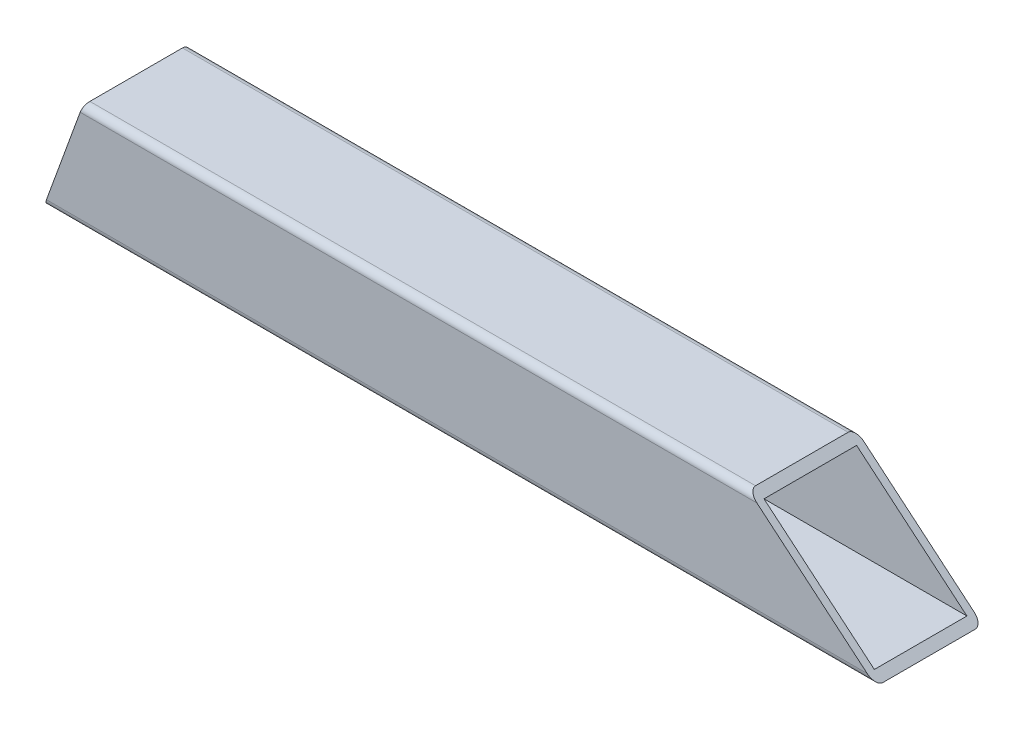
from build123d import *

# Parameters (mm, degrees)
SKETCH1_W               = 130
SKETCH1_H               = 130
EXTRUDE1_DEPTH          = 1168
CUT_EXTRUDE1_DEPTH      = 1188.107408788
CUT_EXTRUDE1_DEPTH_BACK = 1188.107408788
CUT_EXTRUDE2_DEPTH      = 1188.107408788
CUT_EXTRUDE2_DEPTH_BACK = 1188.107408788


with BuildPart() as part:
    # Sketch1 → Extrude1 (new body)
    with BuildSketch(Plane(origin=(0, 0, 0), x_dir=(0, 0, -1), z_dir=(1, 0, 0))):
        with BuildLine():
            Line((10, 0), (140, 0))
            ThreePointArc((140, 0), (147.071067812, 2.928932188), (150, 10))
            Line((150, 10), (150, 140))
            ThreePointArc((150, 140), (147.071067812, 147.071067812), (140, 150))
            Line((140, 150), (10, 150))
            ThreePointArc((10, 150), (2.928932188, 147.071067812), (0, 140))
            Line((0, 140), (0, 10))
            ThreePointArc((0, 10), (2.928932188, 2.928932188), (10, 0))
        make_face()
        with Locations((75, 75)):
            Rectangle(SKETCH1_W, SKETCH1_H, mode=Mode.SUBTRACT)
    extrude(amount=EXTRUDE1_DEPTH)

    # Sketch2 → Cut-Extrude1 (cut, two sides: drawn at the far end of the back side and taken through both)
    with BuildSketch(Plane.XY.offset(-CUT_EXTRUDE1_DEPTH_BACK)):
        Polygon((2979.836763712, -1520.311560184), (1168, 0), (989.236961111, 150), (-822.599802601, 1670.311560184), (2218.023317767, 5293.985087608), (6020.459884081, 2103.36196724), align=None)
    extrude(amount=CUT_EXTRUDE1_DEPTH + CUT_EXTRUDE1_DEPTH_BACK, mode=Mode.SUBTRACT)

    # Sketch3 → Cut-Extrude2 (cut, two sides: drawn at the far end of the back side and taken through both)
    with BuildSketch(Plane.XY.offset(-CUT_EXTRUDE2_DEPTH_BACK)):
        Polygon((-808.940884793, -2222.546814643), (0, 0), (54.59553514, 150), (863.536419933, 2372.546814643), (-3581.557209352, 3990.428584229), (-5254.034514079, -604.665045056), align=None)
    extrude(amount=CUT_EXTRUDE2_DEPTH + CUT_EXTRUDE2_DEPTH_BACK, mode=Mode.SUBTRACT)


solid = part.part
